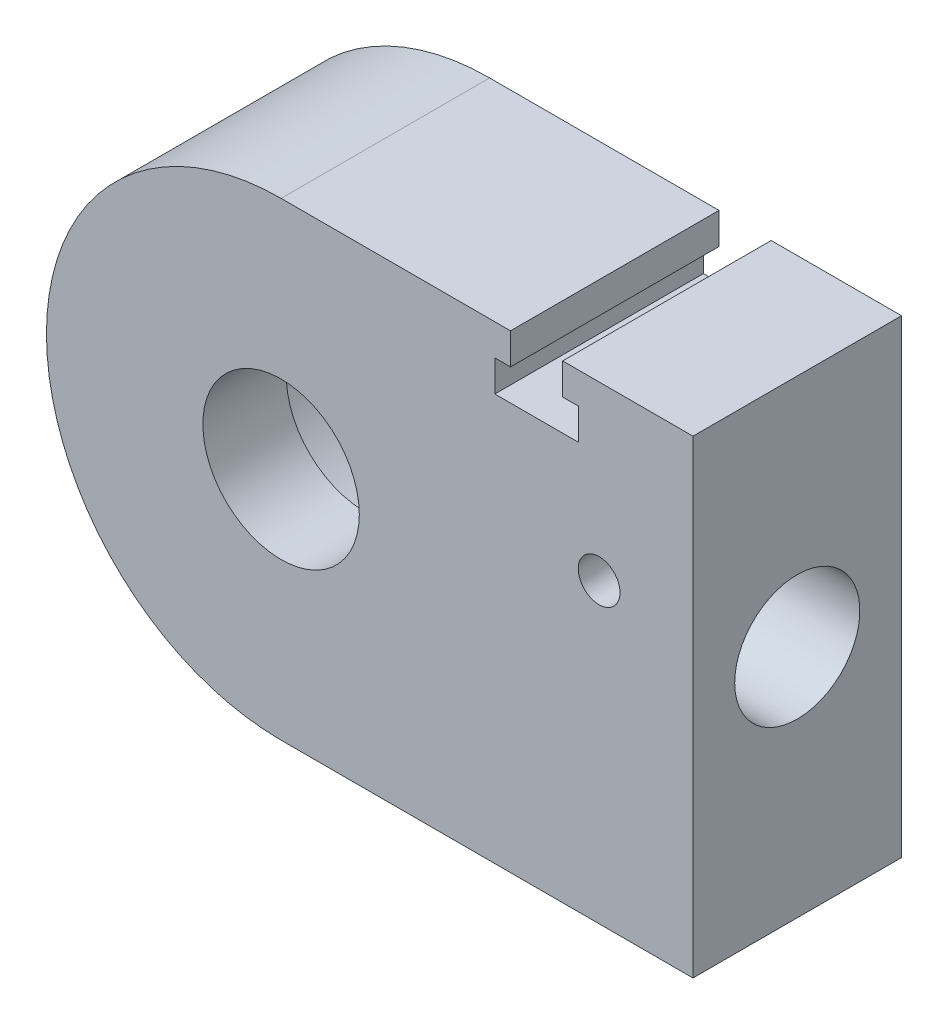
from build123d import *

# Parameters (mm, degrees)
ESQUISSE1_R                  = 7.5
BOSS_EXTRU_1_DEPTH           = 10
ESQUISSE1_3_W                = 17
ESQUISSE1_3_H                = 6
ENL_V_MAT_EXTRU_1_DEPTH      = 2
ENL_V_MAT_EXTRU_1_DEPTH_BACK = 10
ESQUISSE1_5_R                = 14
ENL_V_MAT_EXTRU_2_DEPTH      = 658.559578744
ENL_V_MAT_EXTRU_2_DEPTH_BACK = 658.559578744
ESQUISSE1_6_R                = 2
ENL_V_MAT_EXTRU_3_DEPTH      = 658.559578745
ENL_V_MAT_EXTRU_3_DEPTH_BACK = 658.559578745


with BuildPart() as part:
    # Esquisse1 → Boss.-Extru.1 (new, symmetric)
    with BuildSketch(Plane.XY):
        with BuildLine():
            Line((-634.508066615, 20), (-595.008671928, 20))
            Line((-595.008671928, 20), (-595.008671928, -25))
            Line((-595.008671928, -25), (-634.508066615, -25))
            ThreePointArc((-634.508066615, -25), (-657.008066615, -2.5), (-634.508066615, 20))
        make_face()
        with Locations((-634.508066615, -2.5)):
            Circle(ESQUISSE1_R, mode=Mode.SUBTRACT)
    extrude(amount=BOSS_EXTRU_1_DEPTH, both=True)

    # Esquisse1<3> → Enlèvement de matière-Révolution1 (revolve, cut)
    with BuildSketch(Plane.XY):
        with Locations((-603.508671928, 0.5)):
            Rectangle(ESQUISSE1_3_W, ESQUISSE1_3_H)
    revolve(axis=Axis((-666.113025571, -2.5, 0), (1, 0, 0)), mode=Mode.SUBTRACT)

    # Esquisse1<5> → Enlèv. mat.-Extru.1 (cut, two sides: drawn at the far end of the back side and taken through both)
    with BuildSketch(Plane.XY.offset(-ENL_V_MAT_EXTRU_1_DEPTH_BACK)):
        with Locations((-634.508066615, -2.5)):
            Circle(ESQUISSE1_5_R)
    extrude(amount=ENL_V_MAT_EXTRU_1_DEPTH + ENL_V_MAT_EXTRU_1_DEPTH_BACK, mode=Mode.SUBTRACT)

    # Esquisse1<6> → Enlèv. mat.-Extru.2 (cut, two sides: drawn at the far end of the back side and taken through both)
    with BuildSketch(Plane.XY.offset(-ENL_V_MAT_EXTRU_2_DEPTH_BACK)):
        with Locations((-604.008671928, 3.5)):
            Circle(ESQUISSE1_6_R)
    extrude(amount=ENL_V_MAT_EXTRU_2_DEPTH + ENL_V_MAT_EXTRU_2_DEPTH_BACK, mode=Mode.SUBTRACT)

    # Esquisse1<7> → Enlèv. mat.-Extru.3 (cut, two sides: drawn at the far end of the back side and taken through both)
    with BuildSketch(Plane.XY.offset(-ENL_V_MAT_EXTRU_3_DEPTH_BACK)):
        Polygon((-607.508671928, 20), (-612.508671928, 20), (-612.508671928, 17), (-614.008671928, 17), (-614.008671928, 14), (-606.008671928, 14), (-606.008671928, 17), (-607.508671928, 17), align=None)
    extrude(amount=ENL_V_MAT_EXTRU_3_DEPTH + ENL_V_MAT_EXTRU_3_DEPTH_BACK, mode=Mode.SUBTRACT)


solid = part.part
